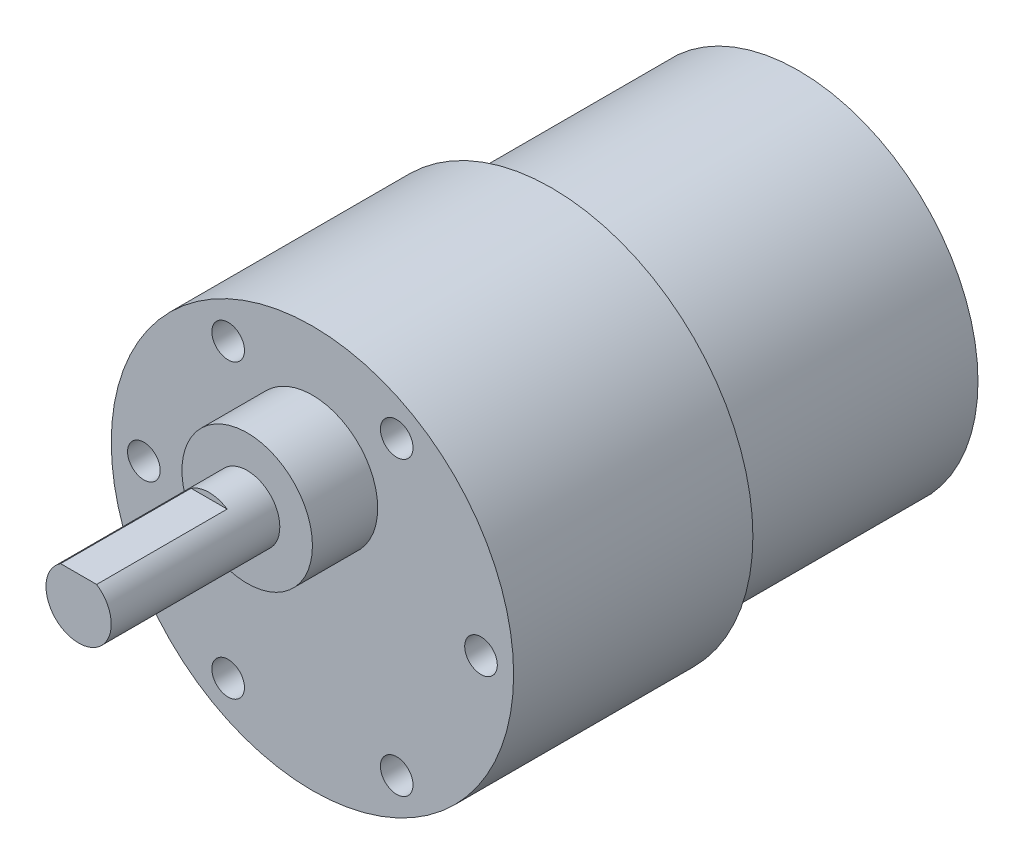
from build123d import *

# Parameters (mm, degrees)
SKETCH_1_R          = 18.5
EXTRUDE_1_DEPTH     = 22
SKETCH_2_R          = 6
EXTRUDE_2_DEPTH     = 6
SKETCH_3_R          = 3
EXTRUDE_3_DEPTH     = 15.5
CUT_EXTRUDE_1_DEPTH = 12
SKETCH_5_R          = 1.5
CUT_EXTRUDE_2_DEPTH = 6
SKETCH_6_R          = 16.5
EXTRUDE_4_DEPTH     = 22.7
SKETCH_7_R          = 8
EXTRUDE_5_DEPTH     = 6


with BuildPart() as part:
    # 草图1 → 凸台-拉伸1 (new body)
    with BuildSketch(Plane.XY):
        Circle(SKETCH_1_R)
    extrude(amount=EXTRUDE_1_DEPTH)

    # 草图2 → 凸台-拉伸2 (add)
    with BuildSketch(Plane.XY.offset(22)):
        with Locations((0, 7)):
            Circle(SKETCH_2_R)
    extrude(amount=EXTRUDE_2_DEPTH)

    # 草图3 → 凸台-拉伸3 (add)
    with BuildSketch(Plane.XY.offset(28)):
        with Locations((0, 7)):
            Circle(SKETCH_3_R)
    extrude(amount=EXTRUDE_3_DEPTH)

    # 草图4 → 切除-拉伸1 (cut)
    with BuildSketch(Plane.XY.offset(43.5)):
        Polygon((-3.340950009, 9.5), (3.684231377, 9.5), (0.516334163, 11.681498446), align=None)
    extrude(amount=-CUT_EXTRUDE_1_DEPTH, mode=Mode.SUBTRACT)

    # 草图5 → 切除-拉伸2 (cut)
    with BuildSketch(Plane.XY.offset(22)):
        with Locations((15.5, 0)):
            Circle(SKETCH_5_R)
        with Locations((7.75, -13.423393759)):
            Circle(SKETCH_5_R)
        with Locations((-7.75, -13.423393759)):
            Circle(SKETCH_5_R)
        with Locations((-15.5, 0)):
            Circle(SKETCH_5_R)
        with Locations((-7.75, 13.423393759)):
            Circle(SKETCH_5_R)
        with Locations((7.75, 13.423393759)):
            Circle(SKETCH_5_R)
    extrude(amount=-CUT_EXTRUDE_2_DEPTH, mode=Mode.SUBTRACT)

    # 草图6 → 凸台-拉伸4 (add)
    with BuildSketch(Plane(origin=(0, 0, 0), x_dir=(-1, 0, 0), z_dir=(0, 0, -1))):
        with Locations(Location((0, 0, 0), (0, 0, 180))):
            Circle(SKETCH_6_R)
    extrude(amount=EXTRUDE_4_DEPTH)

    # 草图7 → 凸台-拉伸5 (add)
    with BuildSketch(Plane(origin=(0, 0, -22.7), x_dir=(-1, 0, 0), z_dir=(0, 0, -1))):
        Circle(SKETCH_7_R)
    extrude(amount=EXTRUDE_5_DEPTH)


solid = part.part
